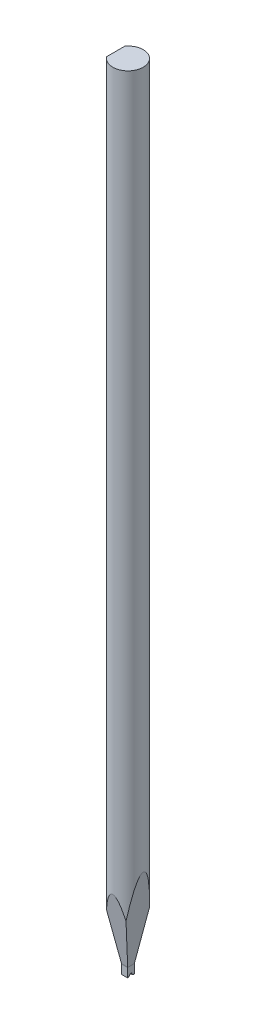
from build123d import *

# Parameters (mm, degrees)
SKETCH_TL_CUTTING_R    = 1.4986
TL_CUTTING_DEPTH       = 78.0034
SKETCH_TDF_CUTTING_W   = 3.01719996
SKETCH_TDF_CUTTING_H   = 3.01719996
TDF_CUTTING_DEPTH      = 79.032185766
VW_VR_GRINDING_DEPTH   = 1.50859998
VW_VR_GRINDING_2_DEPTH = 1.50859998
ISA_GRINDING_DEPTH     = 1.50859998
SKETCH_PRE_FRX_BRX_W   = 1.19142002
SKETCH_PRE_FRX_BRX_H   = 0.89916
SKETCH_PRE_FRX_BRX_W_2 = 1.21633996
PRE_FRX_BRX_DEPTH      = 1.50859998
FA_BA_GRINDING_DEPTH   = 1.50859998
BR_EDM_R               = 0.09906
FR_EDM_R               = 0.0508
ENGRAVING_DEPTH        = 0.005


with BuildPart() as part:
    # sketch_TL_cutting → TL_cutting (new body)
    with BuildSketch(Plane(origin=(0, 0, 0), x_dir=(1, 0, 0), z_dir=(0, 1, 0))):
        with Locations(Location((0, 0, 0), (0, 0, 270))):
            Circle(SKETCH_TL_CUTTING_R)
    extrude(amount=TL_CUTTING_DEPTH)

    # sketch_TDF_cutting → TDF_cutting (cut, through all)
    with BuildSketch(Plane(origin=(0, 0, 0), x_dir=(1, 0, 0), z_dir=(0, 1, 0))):
        with Locations((-2.71001998, 0)):
            Rectangle(SKETCH_TDF_CUTTING_W, SKETCH_TDF_CUTTING_H)
    extrude(amount=TDF_CUTTING_DEPTH, mode=Mode.SUBTRACT)


with BuildPart() as body_2:
    # sketch_VW_VR_grinding → VW_VR_grinding (new, symmetric)
    with BuildSketch(Plane(origin=(0, 0, 0), x_dir=(0, 0, -1), z_dir=(1, 0, 0))):
        with BuildLine():
            Line((-0.32512, -0.00999998), (-0.32512, 0.876937879))
            ThreePointArc((-0.32512, 0.876937879), (-0.326086547, 0.899075438), (-0.328978831, 0.921044517))
            Line((-0.328978831, 0.921044517), (-1.51859996, 7.667721199))
            Line((-1.51859996, 7.667721199), (-1.50859998, -0.00999998))
            Line((-1.50859998, -0.00999998), (-0.32512, -0.00999998))
        make_face()
    extrude(amount=VW_VR_GRINDING_DEPTH, both=True)


with BuildPart() as body_3:
    # sketch_VW_VR_grinding → VW_VR_grinding 2 (new, symmetric)
    with BuildSketch(Plane(origin=(0, 0, 0), x_dir=(0, 0, -1), z_dir=(1, 0, 0))):
        with BuildLine():
            Line((0.32512, -0.00999998), (0.32512, 0.876937879))
            ThreePointArc((0.32512, 0.876937879), (0.326086547, 0.899075438), (0.328978831, 0.921044517))
            Line((0.328978831, 0.921044517), (1.51859996, 7.667721199))
            Line((1.51859996, 7.667721199), (1.50859998, -0.00999998))
            Line((1.50859998, -0.00999998), (0.32512, -0.00999998))
        make_face()
    extrude(amount=VW_VR_GRINDING_2_DEPTH, both=True)


    add(body_2.part)  # ISA_grinding merges body 2
    # sketch_ISA_grinding → ISA_grinding (add, symmetric)
    with BuildSketch(Plane(origin=(0, 0, 0), x_dir=(0, 0, -1), z_dir=(1, 0, 0))):
        Polygon((-0.32512, 0), (0.32512, 0), (1.50859998, 6.711848494), (1.50859998, -0.02999994), (-1.50859998, -0.02999994), (-1.50859998, 6.711848494), align=None)
    extrude(amount=ISA_GRINDING_DEPTH, both=True)

    # sketch_pre_FRX_BRX → pre_FRX_BRX (add, symmetric)
    with BuildSketch(Plane.XY):
        with Locations((0.90288999, 0.43958002)):
            Rectangle(SKETCH_PRE_FRX_BRX_W, SKETCH_PRE_FRX_BRX_H)
        with Locations((-0.91042998, 0.43958002)):
            Rectangle(SKETCH_PRE_FRX_BRX_W_2, SKETCH_PRE_FRX_BRX_H)
    extrude(amount=PRE_FRX_BRX_DEPTH, both=True)

    # sketch_FA_BA_grinding → FA_BA_grinding (add, symmetric)
    with BuildSketch(Plane.XY):
        Polygon((0.29718, -0.00999998), (0.29718, 0.89916), (1.6256, 10.351359447), (1.6256, -0.00999998), align=None)
        Polygon((-0.30226, -0.00999998), (-0.30226, 0.89916), (-1.32842, 8.200667794), (-1.32842, -0.00999998), align=None)
    extrude(amount=FA_BA_GRINDING_DEPTH, both=True)


with BuildPart() as part_1:
    add(part.part)

    # B1_fix: cut body 3
    add(body_3.part, mode=Mode.SUBTRACT)

    # V-Groove_EDM: sweep along a path in sketch_contour_V-Groove
    with BuildLine(Plane.XY) as v_groove_edm_path:
        Line((-1.20142, 0.16002), (1.4986, 0.16002))
    # sketch_section_V-Groove → V-Groove_EDM (sweep, cut)
    with BuildSketch(Plane(origin=(-1.20142, 0, -1.2954), x_dir=(0, 0, -1), z_dir=(1, 0, 0))):
        with BuildLine():
            Line((-1.26010487, 0.144673241), (-1.115869758, -0.00999998))
            Line((-1.115869758, -0.00999998), (-1.474930242, -0.00999998))
            Line((-1.474930242, -0.00999998), (-1.33069513, 0.144673241))
            ThreePointArc((-1.33069513, 0.144673241), (-1.2954, 0.16002), (-1.26010487, 0.144673241))
        make_face()
    sweep(path=v_groove_edm_path.line, mode=Mode.SUBTRACT)

    # BR_EDM
    br_edm_edges = [part_1.edges().sort_by_distance(p)[0] for p in [
        (0.29718, 0.07233662, -0.102750119),
        (0.29718, 0.16002, 0),
        (0.29718, 0.07233662, 0.102750119),
    ]]
    fillet(br_edm_edges, radius=BR_EDM_R)

    # FR_EDM
    fr_edm_edges = [part_1.edges().sort_by_distance(p)[0] for p in [
        (-0.30226, 0.07233662, -0.102750119),
        (-0.30226, 0.16002, 0),
        (-0.30226, 0.07233662, 0.102750119),
    ]]
    fillet(fr_edm_edges, radius=FR_EDM_R)

    # sketch_Engraving → Engraving (cut)
    # profile 1 of 9: a face of its own
    with BuildSketch(Plane.ZY.offset(1.20142)):
        Polygon((-1.243778574, 46.108238925), (-1.116218735, 46.234243156), (-0.926693853, 46.361025191), (-0.67598173, 46.488844298), (-0.359674813, 46.550809342), (-0.105332939, 46.550809342), (0.210973979, 46.488844298), (0.463500977, 46.361025191), (0.65302586, 46.234243156), (0.780585699, 46.108238925), (0.75880719, 46.08723822), (0.635654906, 46.212205379), (0.449500507, 46.336394734), (0.200343992, 46.459806286), (-0.10896269, 46.522808401), (-0.356045061, 46.522808401), (-0.665351744, 46.459806286), (-0.912693382, 46.336394734), (-1.098847782, 46.212205379), (-1.222000065, 46.08723822), align=None)
    # profile 2 of 9: a face of its own
    with BuildSketch(Plane.ZY.offset(1.20142)):
        Polygon((-1.044660777, 45.519389522), (-0.806912053, 45.519389522), (-0.747280421, 45.702951242), (-0.620498386, 45.834659368), (-0.598460609, 45.812362323), (-0.722909232, 45.688691503), (-0.777874041, 45.519389522), (-0.070331763, 45.519389522), (-0.052701542, 45.573057991), (0.010559842, 45.702691974), (0.077450977, 45.769583109), (0.208899835, 45.834659368), (0.344496981, 45.834659368), (0.477501447, 45.700877098), (0.539207223, 45.519389522), (0.780585699, 45.519389522), (0.780585699, 45.486203223), (0.544392582, 45.486203223), (0.544392582, 45.270492275), (0.780585699, 45.270492275), (0.780585699, 45.237305976), (0.539207223, 45.237305976), (0.477760715, 45.052966453), (0.35097868, 44.92203613), (0.328940903, 44.943296103), (0.453389527, 45.068003995), (0.508354335, 45.237305976), (-0.135667291, 45.237305976), (-0.153297512, 45.183637507), (-0.216558896, 45.053225721), (-0.283450031, 44.986334586), (-0.414898889, 44.92203613), (-0.614016686, 44.92203613), (-0.747021153, 45.055040596), (-0.806912053, 45.237305976), (-1.044660777, 45.237305976), (-1.044660777, 45.270492275), (-0.811838144, 45.270492275), (-0.811838144, 45.486203223), (-1.044660777, 45.486203223), align=None)
        Polygon((-0.777874041, 45.237305976), (-0.722390696, 45.07500423), (-0.602608896, 44.956000234), (-0.422936196, 44.956000234), (-0.30133952, 45.017187473), (-0.242226424, 45.076819105), (-0.178705773, 45.198415781), (-0.164705303, 45.241194995), align=None, mode=Mode.SUBTRACT)
        Polygon((-0.081739554, 45.486203223), (-0.778392576, 45.486203223), (-0.778392576, 45.270492275), (-0.155371656, 45.270492275), align=None, mode=Mode.SUBTRACT)
        Polygon((0.509132139, 45.486203223), (-0.05166447, 45.486203223), (-0.125037304, 45.270492275), (0.509132139, 45.270492275), align=None, mode=Mode.SUBTRACT)
        Polygon((-0.042071555, 45.519389522), (0.508354335, 45.515500503), (0.452870991, 45.685580288), (0.333089191, 45.80380648), (0.21590007, 45.80380648), (0.095340467, 45.743397044), (0.03622737, 45.68402468), (-0.027034013, 45.562168736), align=None, mode=Mode.SUBTRACT)
    # profile 3 of 9: a face of its own
    with BuildSketch(Plane.ZY.offset(1.20142)):
        Polygon((-0.124518768, 44.099845559), (-0.124518768, 44.588047137), (-0.785133544, 44.588047137), (-0.785133544, 43.786649857), (-0.81235668, 43.786649857), (-0.81235668, 44.616048078), (0.531688452, 44.616048078), (0.531688452, 43.786649857), (0.502909708, 43.786649857), (0.502909708, 44.588047137), (-0.095740024, 44.588047137), (-0.095740024, 44.099845559), align=None)
    # profile 4 of 9: a face of its own
    with BuildSketch(Plane.ZY.offset(1.20142)):
        Polygon((-0.79576353, 43.515922247), (0.085488284, 43.515922247), (0.085488284, 43.487921307), (-0.131519003, 43.487921307), (0.03622737, 43.322508345), (0.100266558, 43.192355827), (0.100266558, 42.996349245), (0.034412495, 42.862307707), (-0.138778506, 42.806305826), (0.03622737, 42.633114825), (0.100266558, 42.501925235), (0.100266558, 42.306696457), (0.034412495, 42.171877115), (-0.164186767, 42.108097196), (-0.79576353, 42.108097196), (-0.79576353, 42.136098136), (-0.17014993, 42.136098136), (0.009263502, 42.197285376), (0.068895134, 42.313696692), (0.068895134, 42.494925), (0.007448626, 42.6147068), (-0.173520413, 42.797490715), (-0.79576353, 42.797490715), (-0.79576353, 42.826528728), (-0.17014993, 42.826528728), (0.009263502, 42.886938163), (0.068895134, 43.004127284), (0.068895134, 43.18431852), (0.007448626, 43.305137391), (-0.173520413, 43.487921307), (-0.79576353, 43.487921307), align=None)
    # profile 5 of 9: a face of its own
    with BuildSketch(Plane.ZY.offset(1.20142)):
        Polygon((0.086525356, 41.707476336), (-0.067479816, 41.707476336), (0.036486638, 41.60506549), (0.100266558, 41.473875899), (0.100266558, 41.278906389), (0.036486638, 41.148494603), (-0.094702952, 41.01886062), (-0.287598318, 40.954043629), (-0.416973033, 40.954043629), (-0.610127667, 41.01886062), (-0.740280186, 41.148494603), (-0.803282301, 41.278906389), (-0.803282301, 41.473875899), (-0.740280186, 41.60506549), (-0.636313731, 41.707476336), (-1.227185424, 41.707476336), (-1.227185424, 41.735477276), (0.086525356, 41.735477276), align=None)
        Polygon((-0.110518298, 41.707476336), (-0.601571824, 41.707476336), (-0.72057582, 41.586916732), (-0.780985256, 41.466875664), (-0.780985256, 41.285906624), (-0.72057582, 41.165865556), (-0.599756948, 41.044268881), (-0.416973033, 40.983081641), (-0.295117089, 40.983081641), (-0.112333174, 41.044268881), (0.007448626, 41.165865556), (0.068895134, 41.285906624), (0.068895134, 41.466875664), (0.007448626, 41.586916732), align=None, mode=Mode.SUBTRACT)
    # profile 6 of 9: a face of its own
    with BuildSketch(Plane.ZY.offset(1.20142)):
        Polygon((-0.81235668, 40.245153158), (-0.81235668, 40.373750069), (-0.747798957, 40.508569411), (-0.551273839, 40.573386402), (0.062672703, 40.573386402), (0.062672703, 40.746577403), (0.090673643, 40.746577403), (0.090673643, 40.573386402), (0.515095302, 40.573386402), (0.515095302, 40.54434839), (0.090673643, 40.54434839), (0.090673643, 40.30737747), (0.062672703, 40.30737747), (0.062672703, 40.54434839), (-0.547644087, 40.54434839), (-0.726798251, 40.48316115), (-0.785392812, 40.366749834), (-0.785392812, 40.245153158), align=None)
    # profile 7 of 9: a face of its own
    with BuildSketch(Plane.ZY.offset(1.20142)):
        Polygon((-1.21499983, 40.157468732), (-1.21499983, 40.0978371), (-1.154071858, 39.9780553), (-1.033252986, 39.856458624), (-0.794985726, 39.734861949), (0.073302689, 40.107689283), (0.083673408, 40.082281022), (-0.759206747, 39.718268799), (0.083673408, 39.354256576), (0.073302689, 39.329626119), (-0.79835621, 39.705823937), (-1.051661012, 39.831050364), (-1.179480119, 39.960684347), (-1.243778574, 40.090836865), (-1.243778574, 40.157468732), align=None)
    # profile 8 of 9: a face of its own
    with BuildSketch(Plane.ZY.offset(1.20142)):
        Polygon((-1.044660777, 38.835668792), (-0.806912053, 38.835668792), (-0.747280421, 39.019230511), (-0.620498386, 39.150938637), (-0.598460609, 39.128641592), (-0.722909232, 39.004970773), (-0.777874041, 38.835668792), (-0.070331763, 38.835668792), (-0.052701542, 38.88933726), (0.010559842, 39.018971243), (0.077450977, 39.085862378), (0.208899835, 39.150938637), (0.344496981, 39.150938637), (0.477501447, 39.017156367), (0.539207223, 38.835668792), (0.780585699, 38.835668792), (0.780585699, 38.802482492), (0.544392582, 38.802482492), (0.544392582, 38.586771545), (0.780585699, 38.586771545), (0.780585699, 38.553585245), (0.539207223, 38.553585245), (0.477760715, 38.369245722), (0.35097868, 38.2383154), (0.328940903, 38.259575373), (0.453389527, 38.384283264), (0.508354335, 38.553585245), (-0.135667291, 38.553585245), (-0.153297512, 38.499916777), (-0.216558896, 38.36950499), (-0.283450031, 38.302613855), (-0.414898889, 38.2383154), (-0.614016686, 38.2383154), (-0.747021153, 38.371319866), (-0.806912053, 38.553585245), (-1.044660777, 38.553585245), (-1.044660777, 38.586771545), (-0.811838144, 38.586771545), (-0.811838144, 38.802482492), (-1.044660777, 38.802482492), align=None)
        Polygon((-0.777874041, 38.553585245), (-0.722390696, 38.391283499), (-0.602608896, 38.272279503), (-0.422936196, 38.272279503), (-0.30133952, 38.333466743), (-0.242226424, 38.393098375), (-0.178705773, 38.514695051), (-0.164705303, 38.557474265), align=None, mode=Mode.SUBTRACT)
        Polygon((-0.081739554, 38.802482492), (-0.778392576, 38.802482492), (-0.778392576, 38.586771545), (-0.155371656, 38.586771545), align=None, mode=Mode.SUBTRACT)
        Polygon((0.509132139, 38.802482492), (-0.05166447, 38.802482492), (-0.125037304, 38.586771545), (0.509132139, 38.586771545), align=None, mode=Mode.SUBTRACT)
        Polygon((-0.042071555, 38.835668792), (0.508354335, 38.831779772), (0.452870991, 39.001859557), (0.333089191, 39.120085749), (0.21590007, 39.120085749), (0.095340467, 39.059676314), (0.03622737, 39.00030395), (-0.027034013, 38.878448006), align=None, mode=Mode.SUBTRACT)
    # profile 9 of 9: a face of its own
    with BuildSketch(Plane.ZY.offset(1.20142)):
        Polygon((-1.222000065, 37.991958979), (-1.098847782, 37.866732552), (-0.912693382, 37.742543196), (-0.665351744, 37.619131645), (-0.356045061, 37.556129529), (-0.10896269, 37.556129529), (0.200343992, 37.619131645), (0.449500507, 37.742543196), (0.635654906, 37.866732552), (0.75880719, 37.991958979), (0.780585699, 37.969921202), (0.65302586, 37.844954043), (0.463500977, 37.71791274), (0.210973979, 37.590352901), (-0.105332939, 37.527350785), (-0.359674813, 37.527350785), (-0.67598173, 37.590352901), (-0.926693853, 37.71791274), (-1.116218735, 37.844954043), (-1.243778574, 37.969921202), align=None)
    extrude(amount=-ENGRAVING_DEPTH, mode=Mode.SUBTRACT)


solid = part_1.part
